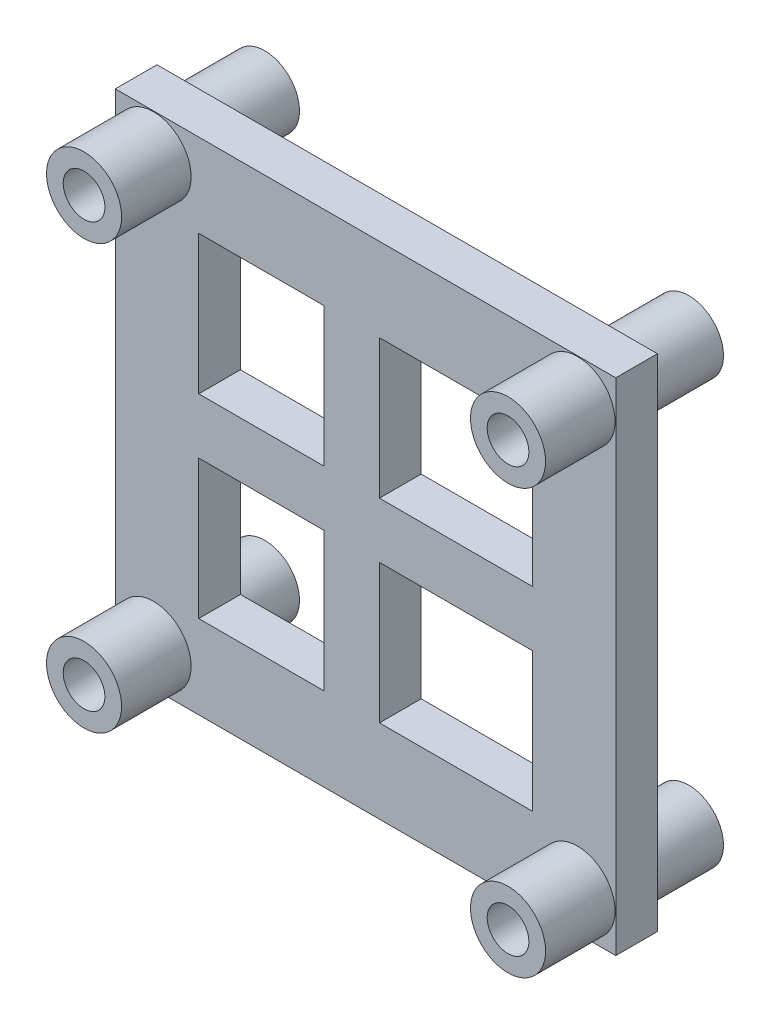
from build123d import *

# Parameters (mm, degrees)
CROQUIS1_W              = 36
CROQUIS1_H              = 36
SALIENTE_EXTRUIR1_DEPTH = 13
CROQUIS5_R              = 1.5
CORTAR_EXTRUIR2_DEPTH   = 13
CROQUIS6_W              = 36
CROQUIS6_H              = 36
CROQUIS6_R              = 2.5
CORTAR_EXTRUIR3_DEPTH   = 5
CROQUIS7_W              = 36
CROQUIS7_H              = 36
CROQUIS7_R              = 2.7
CORTAR_EXTRUIR4_DEPTH   = 5
CROQUIS8_W              = 9
CROQUIS8_H              = 10
CROQUIS8_W_2            = 11
CORTAR_EXTRUIR5_DEPTH   = 3


with BuildPart() as part:
    # Croquis1 → Saliente-Extruir1 (new body)
    with BuildSketch(Plane.XY):
        with Locations((-24.893753741, 2.264150943)):
            Rectangle(CROQUIS1_W, CROQUIS1_H)
    extrude(amount=SALIENTE_EXTRUIR1_DEPTH)

    # Croquis5 → Cortar-Extruir2 (cut)
    with BuildSketch(Plane(origin=(0, 0, 0), x_dir=(-1, 0, 0), z_dir=(0, 0, -1))):
        with Locations((40.143753741, 17.514150943)):
            Circle(CROQUIS5_R)
        with Locations((40.143753741, -12.985849057)):
            Circle(CROQUIS5_R)
        with Locations((9.643753741, -12.985849057)):
            Circle(CROQUIS5_R)
        with Locations((9.643753741, 17.514150943)):
            Circle(CROQUIS5_R)
    extrude(amount=-CORTAR_EXTRUIR2_DEPTH, mode=Mode.SUBTRACT)

    # Croquis6 → Cortar-Extruir3 (cut)
    with BuildSketch(Plane(origin=(0, 0, 0), x_dir=(-1, 0, 0), z_dir=(0, 0, -1))):
        with Locations((24.893753741, 2.264150943)):
            Rectangle(CROQUIS6_W, CROQUIS6_H)
        with Locations((40.143753741, 17.514150943)):
            Circle(CROQUIS6_R, mode=Mode.SUBTRACT)
        with Locations((9.643753741, 17.514150943)):
            Circle(CROQUIS6_R, mode=Mode.SUBTRACT)
        with Locations((40.143753741, -12.985849057)):
            Circle(CROQUIS6_R, mode=Mode.SUBTRACT)
        with Locations((9.643753741, -12.985849057)):
            Circle(CROQUIS6_R, mode=Mode.SUBTRACT)
    extrude(amount=-CORTAR_EXTRUIR3_DEPTH, mode=Mode.SUBTRACT)

    # Croquis7 → Cortar-Extruir4 (cut)
    with BuildSketch(Plane.XY.offset(13)):
        with Locations((-24.893753741, 2.264150943)):
            Rectangle(CROQUIS7_W, CROQUIS7_H)
        with Locations((-40.143753741, 17.514150943)):
            Circle(CROQUIS7_R, mode=Mode.SUBTRACT)
        with Locations((-9.643753741, 17.514150943)):
            Circle(CROQUIS7_R, mode=Mode.SUBTRACT)
        with Locations((-40.143753741, -12.985849057)):
            Circle(CROQUIS7_R, mode=Mode.SUBTRACT)
        with Locations((-9.643753741, -12.985849057)):
            Circle(CROQUIS7_R, mode=Mode.SUBTRACT)
    extrude(amount=-CORTAR_EXTRUIR4_DEPTH, mode=Mode.SUBTRACT)

    # Croquis8 → Cortar-Extruir5 (cut)
    with BuildSketch(Plane.XY.offset(8)):
        with Locations((-32.393753741, -4.735849057)):
            Rectangle(CROQUIS8_W, CROQUIS8_H)
        with Locations((-32.393753741, 9.264150943)):
            Rectangle(CROQUIS8_W, CROQUIS8_H)
        with Locations((-18.393753741, -4.735849057)):
            Rectangle(CROQUIS8_W_2, CROQUIS8_H)
        with Locations((-18.393753741, 9.264150943)):
            Rectangle(CROQUIS8_W_2, CROQUIS8_H)
    extrude(amount=-CORTAR_EXTRUIR5_DEPTH, mode=Mode.SUBTRACT)


solid = part.part
